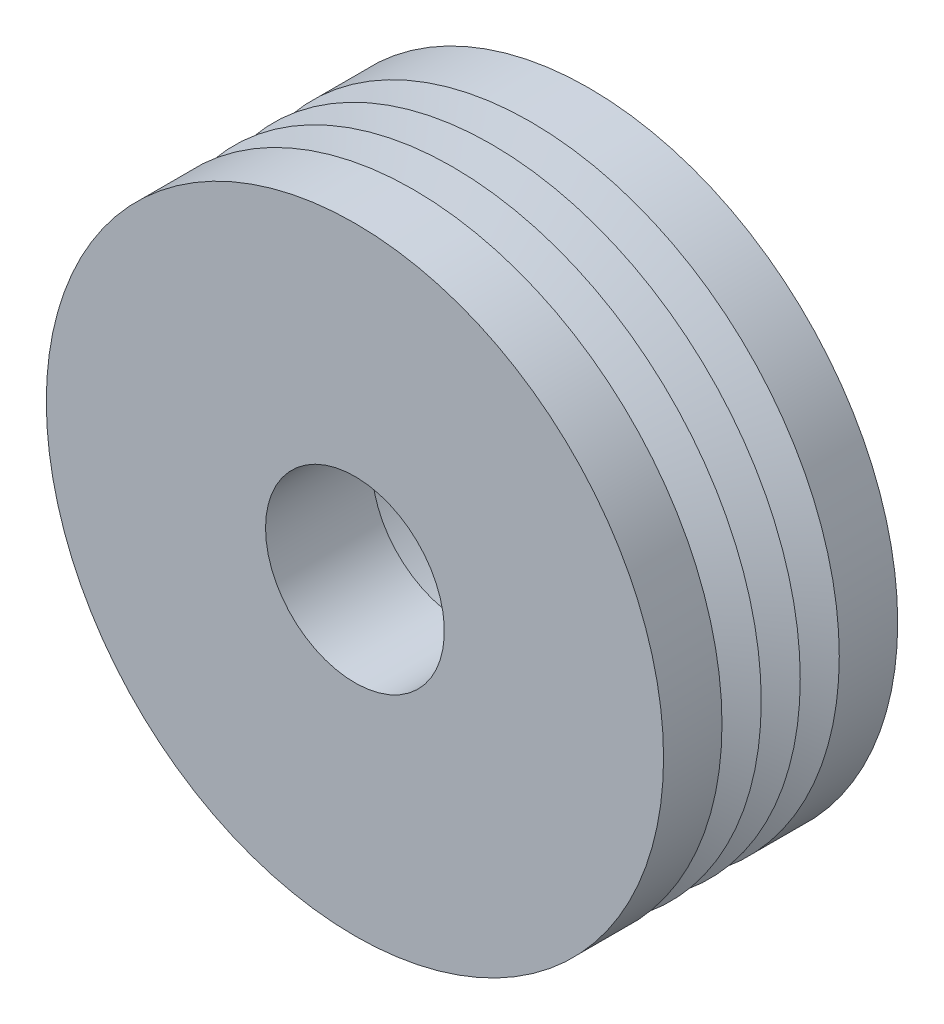
from build123d import *

# Parameters (mm, degrees)
SKETCH3_R          = 4.5
CUT_EXTRUDE1_DEPTH = 3
SKETCH4_R          = 2.1
CUT_EXTRUDE2_DEPTH = 11.68293031


with BuildPart() as part:
    # Sketch2 → Revolve1 (revolve)
    with BuildSketch(Plane(origin=(0, 0, 0), x_dir=(1, 0, 0), z_dir=(0, 1, 0))):
        Polygon((0, 5.5), (-7.25, 5.5), (-7.25, 4.127624556), (-6.25, 3.666666667), (-7.25, 3.210957889), (-6.25, 2.755249111), (-7.25, 2.294291222), (-6.25, 1.833333333), (-7.25, 1.372375444), (-7.25, 0), (0, 0), align=None)
    revolve(axis=Axis((0, 0, -5.5), (0, 0, 1)))

    # Sketch3 → Cut-Extrude1 (cut)
    with BuildSketch(Plane(origin=(0, 0, -5.5), x_dir=(-1, 0, 0), z_dir=(0, 0, -1))):
        Circle(SKETCH3_R)
    extrude(amount=-CUT_EXTRUDE1_DEPTH, mode=Mode.SUBTRACT)

    # Sketch4 → Cut-Extrude2 (cut, through all)
    with BuildSketch(Plane(origin=(0, 0, -2.5), x_dir=(-1, 0, 0), z_dir=(0, 0, -1))):
        Circle(SKETCH4_R)
    extrude(amount=-CUT_EXTRUDE2_DEPTH, mode=Mode.SUBTRACT)


solid = part.part
